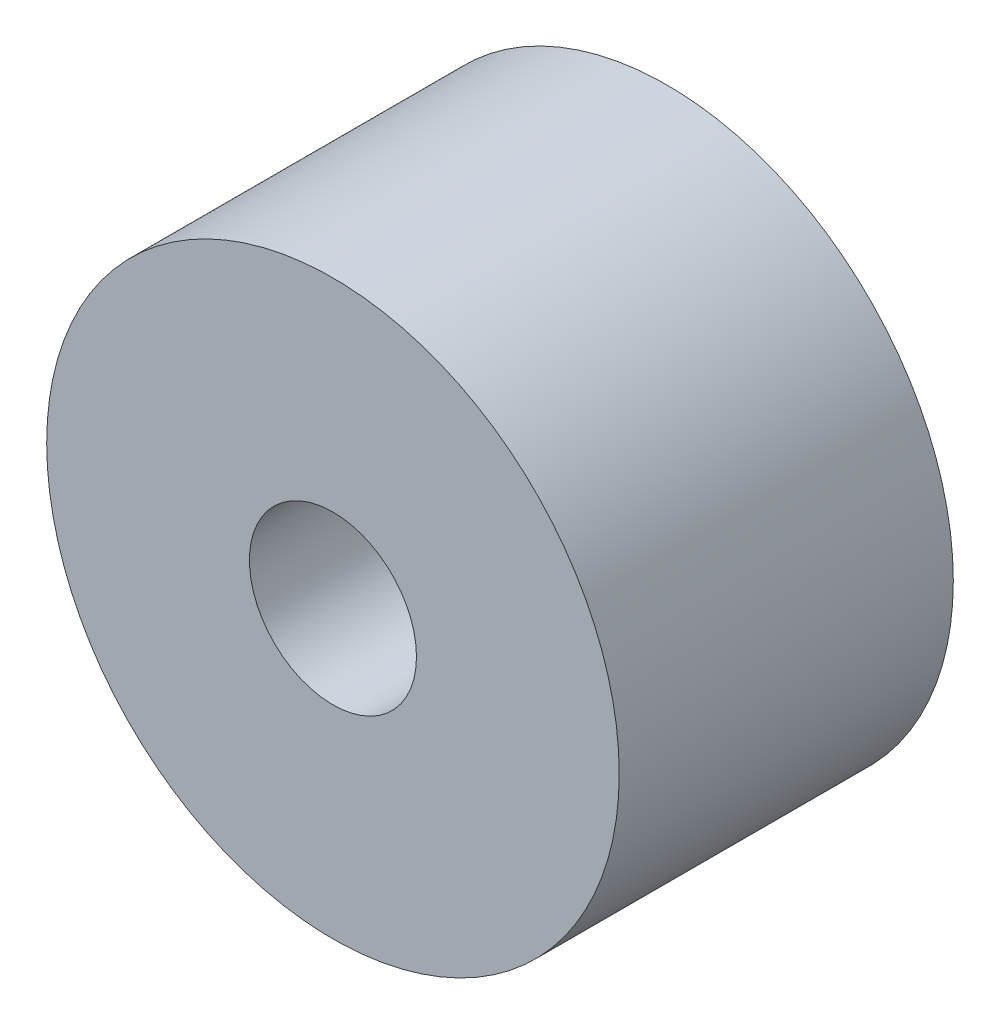
from build123d import *

# Parameters (mm, degrees)
SKETCH1_R           = 10.8824141
SKETCH1_R_2         = 3.175
BOSS_EXTRUDE1_DEPTH = 12.7


with BuildPart() as part:
    # Sketch1 → Boss-Extrude1 (new body)
    with BuildSketch(Plane.XY):
        Circle(SKETCH1_R)
        Circle(SKETCH1_R_2, mode=Mode.SUBTRACT)
    extrude(amount=BOSS_EXTRUDE1_DEPTH)


solid = part.part
